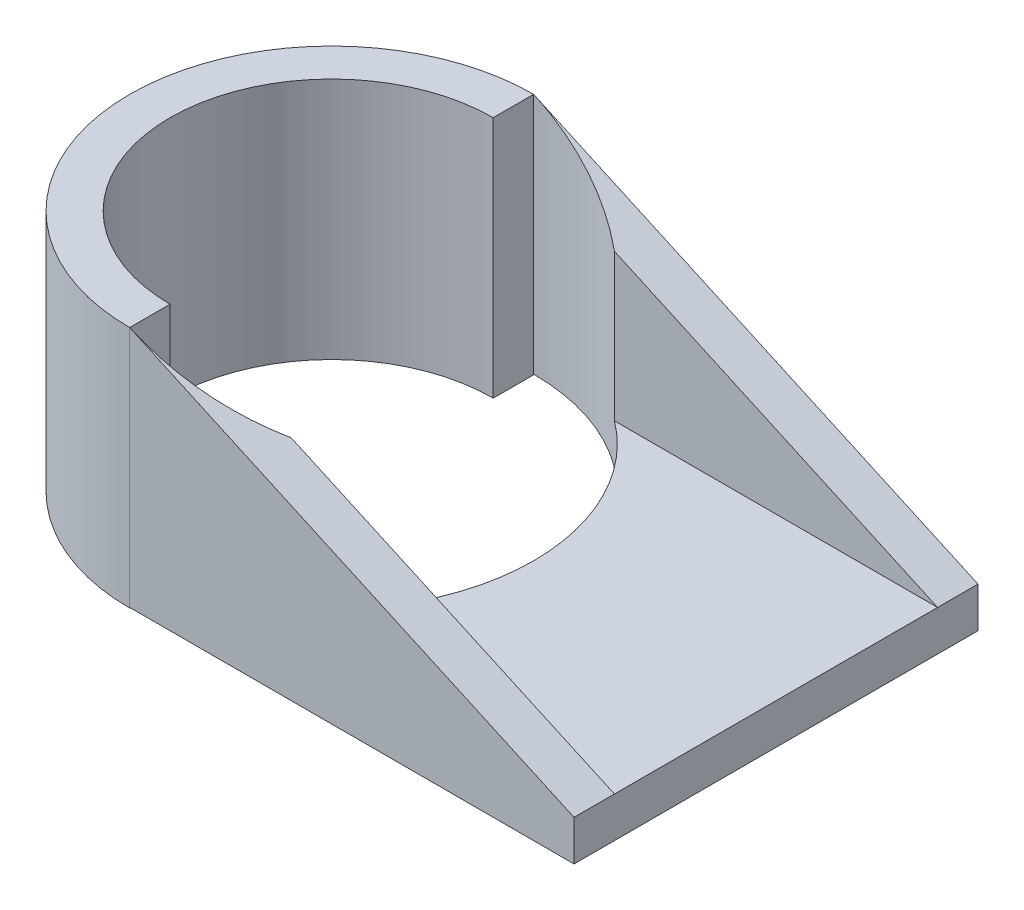
from build123d import *

# Parameters (mm, degrees)
SKETCH2_W                = 110
SKETCH2_H                = 100
BOSS_EXTRUDE1_DEPTH      = 10
BOSS_EXTRUDE2_DEPTH      = 10
BOSS_EXTRUDE3_DEPTH      = 10
BOSS_EXTRUDE4_DEPTH      = 50
BOSS_EXTRUDE4_DEPTH_BACK = 10.136488762
SKETCH5_R                = 50
CUT_EXTRUDE3_DEPTH       = 100
CUT_EXTRUDE4_DEPTH       = 100


with BuildPart() as part:
    # Sketch2 → Boss-Extrude1 (new body)
    with BuildSketch(Plane(origin=(0, 0, 0), x_dir=(1, 0, 0), z_dir=(0, 1, 0))):
        Rectangle(SKETCH2_W, SKETCH2_H)
    extrude(amount=BOSS_EXTRUDE1_DEPTH)

    # Sketch3 → Boss-Extrude2 (add)
    with BuildSketch(Plane.XY.offset(50)):
        Polygon((-55, 10), (-55, 60), (55, 10), align=None)
    extrude(amount=-BOSS_EXTRUDE2_DEPTH)

    # Sketch4 → Boss-Extrude3 (add)
    with BuildSketch(Plane(origin=(0, 0, -50), x_dir=(-1, 0, 0), z_dir=(0, 0, -1))):
        Polygon((55, 10), (55, 60), (-55, 10), align=None)
    extrude(amount=-BOSS_EXTRUDE3_DEPTH)

    # Sketch5 → Boss-Extrude4 (add, two sides: drawn at the far end of the back side and taken through both)
    with BuildSketch(Plane(origin=(0, 10, 0), x_dir=(1, 0, 0), z_dir=(0, 1, 0)).offset(-BOSS_EXTRUDE4_DEPTH_BACK)):
        with Locations(Location((-55, 0, 0), (0, 0, 270))):
            Circle(SKETCH5_R)
    extrude(amount=BOSS_EXTRUDE4_DEPTH + BOSS_EXTRUDE4_DEPTH_BACK)

    # Sketch6 → Cut-Extrude3 (cut)
    with BuildSketch(Plane(origin=(0, 60, 0), x_dir=(1, 0, 0), z_dir=(0, 1, 0))):
        with BuildLine():
            Line((-55, 50), (-55, -50))
            ThreePointArc((-55, -50), (-5, 0), (-55, 50))
        make_face()
    extrude(amount=-CUT_EXTRUDE3_DEPTH, mode=Mode.SUBTRACT)


with BuildPart() as cut_extrude3_piece_1:
    # of the separate pieces the step leaves, piece 1, a body of its own (cut_extrude3_pieces)
    add(part.part.solids().sort_by_distance((-55, -0.136488762, -50))[0])

    # Sketch7 → Cut-Extrude4 (cut)
    with BuildSketch(Plane(origin=(0, 60, 0), x_dir=(1, 0, 0), z_dir=(0, 1, 0))):
        with BuildLine():
            Line((-55, 40), (-55, -40))
            ThreePointArc((-55, -40), (-95, 0), (-55, 40))
        make_face()
    extrude(amount=-CUT_EXTRUDE4_DEPTH, mode=Mode.SUBTRACT)


with BuildPart() as cut_extrude3_piece_2:
    # of the separate pieces the step leaves, piece 2, a body of its own (cut_extrude3_pieces)
    add(part.part.solids().sort_by_distance((55, 10, -50))[0])


solid = Compound([cut_extrude3_piece_1.part, cut_extrude3_piece_2.part])
